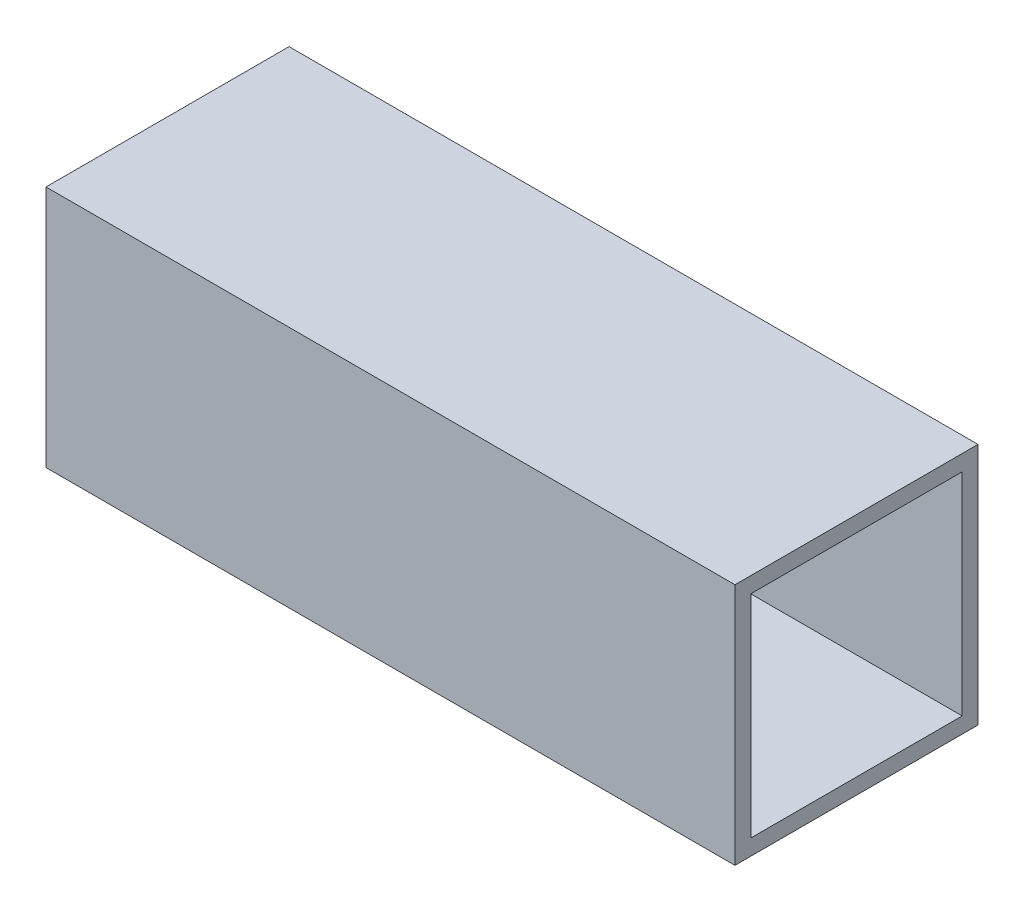
from build123d import *

# Parameters (mm, degrees)
SKETCH16_W                                     = 25.4
SKETCH16_H                                     = 25.4
SKETCH16_W_2                                   = 22.098
SKETCH16_H_2                                   = 22.098
AL_TUBE_SQUARE_AL_TUBE_1_SQR_X_0_065_WAL_DEPTH = 72


with BuildPart() as part:
    # Sketch16 → Al tube square AL TUBE 1 SQR X 0.065 WALL(1) (new body)
    with BuildSketch(Plane(origin=(0, 0, 0), x_dir=(0, 0, -1), z_dir=(1, 0, 0))):
        Rectangle(SKETCH16_W, SKETCH16_H)
        Rectangle(SKETCH16_W_2, SKETCH16_H_2, mode=Mode.SUBTRACT)
    extrude(amount=AL_TUBE_SQUARE_AL_TUBE_1_SQR_X_0_065_WAL_DEPTH)


solid = part.part
